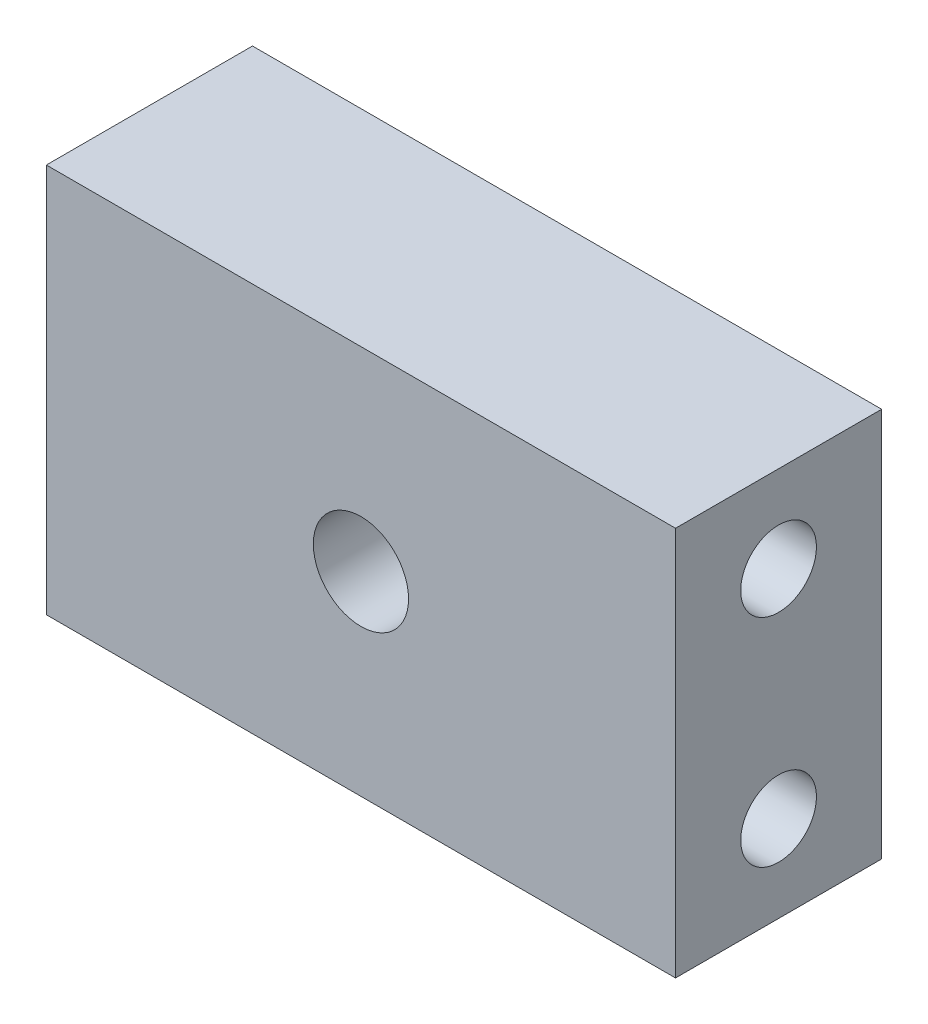
from build123d import *

# Parameters (mm, degrees)
SKETCH1_W         = 29.075
SKETCH1_H         = 18
EXTRUDE_3_8_DEPTH = 9.525
SKETCH2_R         = 1.75
M4_DRILL_DEPTH    = 8
M4_DRILL2_START   = -8
SKETCH3_R         = 1.75
M4_DRILL2_DEPTH   = 8
SKETCH5_R         = 2.2
M5_DRILL_DEPTH    = 9.525


with BuildPart() as part:
    # Sketch1 → 3/8 (new body)
    with BuildSketch(Plane.XY):
        Rectangle(SKETCH1_W, SKETCH1_H)
    extrude(amount=EXTRUDE_3_8_DEPTH)

    # Sketch2 → M4_DRILL (cut)
    with BuildSketch(Plane.ZY.offset(14.5375)):
        with Locations((4.7625, 5)):
            Circle(SKETCH2_R)
        with Locations(Location((4.7625, -5, 0), (0, 0, 180))):
            Circle(SKETCH2_R)
    extrude(amount=-M4_DRILL_DEPTH, mode=Mode.SUBTRACT)

    # Sketch3 → M4_DRILL2 (cut)
    with BuildSketch(Plane(origin=(14.5375, 0, 0), x_dir=(0, 0, -1), z_dir=(1, 0, 0)).offset(M4_DRILL2_START)):
        with Locations((-4.7625, -5)):
            Circle(SKETCH3_R)
        with Locations(Location((-4.7625, 5, 0), (0, 0, 180))):
            Circle(SKETCH3_R)
    extrude(amount=M4_DRILL2_DEPTH, mode=Mode.SUBTRACT)

    # Sketch5 → M5_DRILL (cut)
    with BuildSketch(Plane(origin=(0, 0, 0), x_dir=(-1, 0, 0), z_dir=(0, 0, -1))):
        Circle(SKETCH5_R)
    extrude(amount=-M5_DRILL_DEPTH, mode=Mode.SUBTRACT)


solid = part.part
